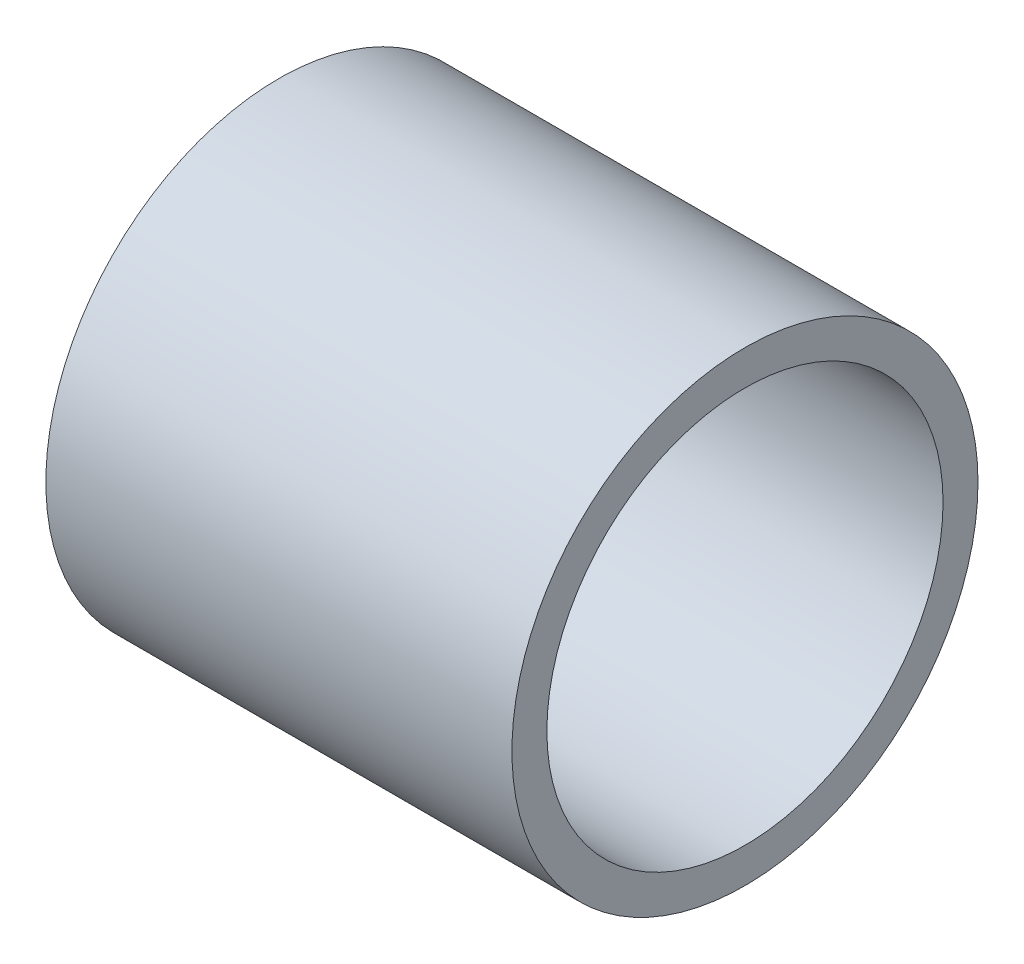
from build123d import *

# Parameters (mm, degrees)
SKETCH_1_R      = 10
SKETCH_1_R_2    = 8.5
EXTRUDE_1_DEPTH = 20


with BuildPart() as part:
    # 草图1 → 凸台-拉伸1 (new body)
    with BuildSketch(Plane(origin=(0, 0, 0), x_dir=(0, 0, -1), z_dir=(1, 0, 0))):
        Circle(SKETCH_1_R)
        Circle(SKETCH_1_R_2, mode=Mode.SUBTRACT)
    extrude(amount=EXTRUDE_1_DEPTH)


solid = part.part
